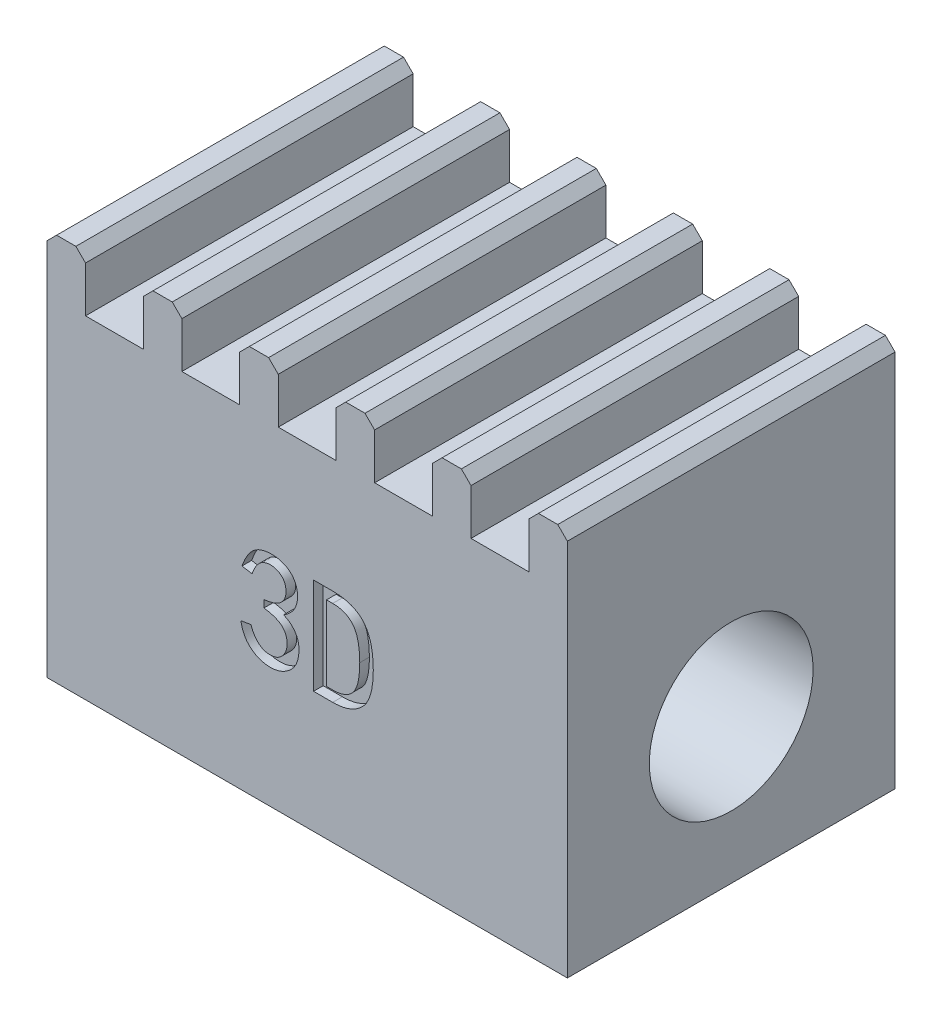
from build123d import *

# Parameters (mm, degrees)
EXTRUDE_1_DEPTH     = 6.8
SKETCH_2_R          = 1.7
CUT_EXTRUDE_1_DEPTH = 4
CUT_EXTRUDE_2_DEPTH = 0.2


with BuildPart() as part:
    # 草图1 → 凸台-拉伸1 (new body)
    with BuildSketch(Plane.XY):
        Polygon((-5.4, 3.45), (-5.4, 4.4), (-5.2, 4.6), (-4.8, 4.6), (-4.6, 4.4), (-4.6, 3.45), (-3.4, 3.45), (-3.4, 4.4), (-3.2, 4.6), (-2.8, 4.6), (-2.6, 4.4), (-2.6, 3.45), (-1.4, 3.45), (-1.4, 4.4), (-1.2, 4.6), (-0.8, 4.6), (-0.6, 4.4), (-0.6, 3.45), (0.6, 3.45), (0.6, 4.4), (0.8, 4.6), (1.2, 4.6), (1.4, 4.4), (1.4, 3.45), (2.6, 3.45), (2.6, 4.4), (2.8, 4.6), (3.2, 4.6), (3.4, 4.4), (3.4, 3.45), (4.6, 3.45), (4.6, 4.4), (4.8, 4.6), (5.2, 4.6), (5.4, 4.4), (5.4, 3.45), (5.4, -3.45), (-5.4, -3.45), align=None)
    extrude(amount=EXTRUDE_1_DEPTH)

    # 草图2 → 切除-拉伸1 (cut)
    with BuildSketch(Plane(origin=(5.4, 0, 0), x_dir=(0, 0, -1), z_dir=(1, 0, 0))):
        with Locations((-3.4, -0.45)):
            Circle(SKETCH_2_R)
    cut_extrude_1 = extrude(amount=-CUT_EXTRUDE_1_DEPTH, mode=Mode.SUBTRACT)

    # 镜向1: 切除-拉伸1 across plane
    add(cut_extrude_1.mirror(Plane(origin=(0, 0, 0), x_dir=(0, 0, 1), z_dir=(1, 0, 0))), mode=Mode.SUBTRACT)

    # 草图3 → 切除-拉伸2 (cut)
    # profile 1 of 2: a face of its own
    with BuildSketch(Plane.XY.offset(6.8)):
        with BuildLine():
            Line((-1.376457279, -0.416282911), (-1.165930963, -0.381195192))
            add(Edge.make_bspline(
                [(-1.165930963, -0.381195192), (-1.15763244, -0.405720082), (-1.141333021, -0.453890272), (-1.106114077, -0.520415987), (-1.06401868, -0.580441449), (-1.023632873, -0.625393193), (-0.987128455, -0.656089708), (-0.958336566, -0.676176694), (-0.928077592, -0.693408889), (-0.89549861, -0.706052061), (-0.861800678, -0.716931797), (-0.826074572, -0.723038647), (-0.789007316, -0.726527707), (-0.75086723, -0.727127825), (-0.712853637, -0.723652622), (-0.676142005, -0.716705208), (-0.641313357, -0.706435041), (-0.608513045, -0.692092384), (-0.57820423, -0.673507247), (-0.549219408, -0.652372243), (-0.522672765, -0.626964076), (-0.49881828, -0.598059787), (-0.477243557, -0.567033353), (-0.458598286, -0.534613197), (-0.443195955, -0.501016549), (-0.431688977, -0.466229957), (-0.422739411, -0.430503677), (-0.417800497, -0.393612088), (-0.415432215, -0.35565775), (-0.416983009, -0.31712675), (-0.420906258, -0.279081503), (-0.428920795, -0.242717218), (-0.439701922, -0.208675324), (-0.453084085, -0.176315733), (-0.47051918, -0.146751715), (-0.490593904, -0.119099091), (-0.513736873, -0.093696828), (-0.540511452, -0.070687756), (-0.570644969, -0.049329268), (-0.604803739, -0.029605977), (-0.643467015, -0.01228199), (-0.685817718, 0.004418275), (-0.732721754, 0.018488043), (-0.783575046, 0.031430681), (-0.838791546, 0.042751158), (-0.877113145, 0.048553553), (-0.896925115, 0.051553346)],
                knots=[0, 0, 0, 0, 1.854799748, 3.643076762, 5.375778243, 7.105784308, 7.958514958, 8.791774595, 9.621744654, 10.44880128, 11.294076632, 12.157496915, 13.041787632, 13.96367637, 14.889223527, 15.774908308, 16.640004354, 17.48869958, 18.334228731, 19.185637365, 20.057465777, 20.961908388, 21.86984341, 22.765285775, 23.641349219, 24.5158806, 25.390105247, 26.279235462, 27.181837661, 28.114543598, 29.042174801, 29.921843334, 30.780091711, 31.601551697, 32.427634894, 33.235597725, 34.049381879, 34.886366892, 35.762920031, 36.695625967, 37.710569643, 38.799256358, 39.959035312, 41.220118669, 42.562822875, 44, 44, 44, 44], degree=3))
            Line((-0.896925115, 0.051553346), (-0.896925115, 0.20360013))
            add(Edge.make_bspline(
                [(-0.896925115, 0.20360013), (-0.877102803, 0.205624125), (-0.838732222, 0.209542026), (-0.783592337, 0.219919832), (-0.73252684, 0.231607377), (-0.685759879, 0.24645762), (-0.64313542, 0.263760481), (-0.604483252, 0.283421007), (-0.570279532, 0.306231941), (-0.540274623, 0.331436475), (-0.514036455, 0.358836798), (-0.491897392, 0.388427632), (-0.473437619, 0.41989829), (-0.459025031, 0.453519731), (-0.448862104, 0.489225261), (-0.441568924, 0.526744143), (-0.439416403, 0.566295622), (-0.440177922, 0.607006927), (-0.44453457, 0.647319158), (-0.45381178, 0.685521825), (-0.466873068, 0.720849463), (-0.483543727, 0.753665386), (-0.505334184, 0.7829203), (-0.530505308, 0.809563191), (-0.559851093, 0.833067456), (-0.592673385, 0.853254273), (-0.627802718, 0.869741353), (-0.663754841, 0.88316544), (-0.700527363, 0.891218179), (-0.737666033, 0.895588031), (-0.775475478, 0.896270811), (-0.813769721, 0.891555392), (-0.852666503, 0.883295144), (-0.891899693, 0.870899188), (-0.930930731, 0.853411579), (-0.967535555, 0.828157067), (-1.001766118, 0.796453548), (-1.034803738, 0.758894021), (-1.06456786, 0.713873849), (-1.093326604, 0.663038736), (-1.119856183, 0.605522066), (-1.134768187, 0.56427575), (-1.14253915, 0.542781416)],
                knots=[0, 0, 0, 0, 1.385117707, 2.68120955, 3.899080185, 5.026526245, 6.089471502, 7.095537128, 8.036926677, 8.942108935, 9.815771246, 10.669349366, 11.506404864, 12.347666396, 13.205663414, 14.084102859, 14.999917747, 15.954128211, 16.914501223, 17.813254747, 18.680661639, 19.529560311, 20.363114732, 21.208382436, 22.07252795, 22.96987783, 23.881720011, 24.767988279, 25.632833695, 26.492298631, 27.366018653, 28.255410494, 29.169296362, 30.128408489, 31.112431375, 32.1318401, 33.205217515, 34.351116983, 35.601710711, 36.950682265, 38.410935554, 40, 40, 40, 40], degree=3))
            Line((-1.14253915, 0.542781416), (-1.353065466, 0.577869136))
            add(Edge.make_bspline(
                [(-1.353065466, 0.577869136), (-1.340793285, 0.611744799), (-1.316879833, 0.677754581), (-1.272193363, 0.770574903), (-1.220331745, 0.854226052), (-1.171714163, 0.91736037), (-1.129011661, 0.962701667), (-1.09359988, 0.991929444), (-1.056061554, 1.018493878), (-1.015415176, 1.040719324), (-0.972142829, 1.059675069), (-0.92603079, 1.074176188), (-0.877369031, 1.085458897), (-0.826662811, 1.093114665), (-0.775569612, 1.097171252), (-0.725365722, 1.098820261), (-0.676783535, 1.096292679), (-0.629667954, 1.091993192), (-0.584401991, 1.083503784), (-0.540718241, 1.072389942), (-0.498890577, 1.057433937), (-0.458435143, 1.040360574), (-0.420634444, 1.019940944), (-0.385029835, 0.997578556), (-0.353166927, 0.971615638), (-0.323186024, 0.944170405), (-0.297447376, 0.912952972), (-0.273680008, 0.879846158), (-0.252956184, 0.844063947), (-0.235779566, 0.805775108), (-0.221432482, 0.766124834), (-0.210696412, 0.725060661), (-0.202686452, 0.683269257), (-0.198928345, 0.640329328), (-0.198488519, 0.596734458), (-0.201605674, 0.552133324), (-0.208192507, 0.50669249), (-0.217944253, 0.460527619), (-0.231978168, 0.414390927), (-0.252185769, 0.36951998), (-0.277869794, 0.326168756), (-0.308982374, 0.284273582), (-0.345474393, 0.243875132), (-0.387889354, 0.205480769), (-0.435202089, 0.16788756), (-0.469762398, 0.14514302), (-0.48756839, 0.133424691)],
                knots=[0, 0, 0, 0, 2.088435488, 4.069504719, 5.960900737, 7.786563479, 8.680771598, 9.566313178, 10.444341104, 11.343825986, 12.247587673, 13.179685867, 14.142420713, 15.141886465, 16.150152099, 17.113396579, 18.05212794, 18.969441419, 19.854666253, 20.719823891, 21.58047219, 22.428151748, 23.263500765, 24.069461113, 24.861911808, 25.643808195, 26.422154676, 27.202794716, 28.005617324, 28.815006474, 29.633397489, 30.44783822, 31.273903418, 32.097929155, 32.94366283, 33.799737089, 34.68784804, 35.604243899, 36.533818883, 37.478357806, 38.450549751, 39.450331118, 40.49965591, 41.60193164, 42.764479089, 44, 44, 44, 44], degree=3))
            add(Edge.make_bspline(
                [(-0.48756839, 0.133424691), (-0.461435398, 0.121056438), (-0.410274319, 0.096842862), (-0.341860196, 0.047856524), (-0.283129917, -0.009901885), (-0.242483511, -0.065185088), (-0.215016138, -0.113397223), (-0.198664978, -0.153024472), (-0.186164716, -0.195313932), (-0.17713201, -0.240109514), (-0.171398966, -0.287615196), (-0.169963189, -0.337880484), (-0.171640239, -0.390995768), (-0.177289867, -0.445840079), (-0.186321541, -0.500895827), (-0.200814692, -0.553906024), (-0.219348169, -0.604287796), (-0.24252824, -0.652134021), (-0.270544786, -0.697026752), (-0.303633034, -0.738874502), (-0.340317709, -0.778602596), (-0.381935441, -0.814518117), (-0.426028711, -0.847238605), (-0.472303174, -0.875585339), (-0.519925618, -0.899498575), (-0.569082331, -0.918674969), (-0.619737742, -0.93300469), (-0.671776947, -0.942902399), (-0.725382615, -0.948696957), (-0.779870876, -0.949314302), (-0.834217929, -0.946074601), (-0.887125749, -0.937949405), (-0.938436971, -0.927113832), (-0.987690916, -0.911069423), (-1.035450599, -0.891897846), (-1.080867784, -0.867783805), (-1.124696171, -0.840265471), (-1.166495326, -0.808920688), (-1.205634613, -0.773347663), (-1.241220162, -0.733666232), (-1.273582323, -0.690415685), (-1.300955949, -0.642615433), (-1.326188756, -0.591823591), (-1.346483063, -0.536633778), (-1.36425914, -0.477996172), (-1.372330552, -0.437160993), (-1.376457279, -0.416282911)],
                knots=[0, 0, 0, 0, 1.556863988, 3.047903747, 4.51274202, 5.983117829, 6.732724558, 7.500714565, 8.289161914, 9.10779992, 9.96267821, 10.866591561, 11.817204889, 12.826910154, 13.838355827, 14.822602624, 15.786048742, 16.729939345, 17.685039949, 18.633769323, 19.603521256, 20.596937443, 21.593797024, 22.562140776, 23.519904659, 24.464277043, 25.403497682, 26.355035653, 27.318261422, 28.307425488, 29.290655039, 30.251043242, 31.192037974, 32.115630974, 33.041191859, 33.964292232, 34.884727864, 35.830159304, 36.778345149, 37.732302073, 38.701115445, 39.685485474, 40.699027657, 41.756353326, 42.852875359, 44, 44, 44, 44], degree=3))
        make_face()
    # profile 2 of 2: a face of its own
    with BuildSketch(Plane.XY.offset(6.8)):
        with BuildLine():
            add(Edge.make_bspline(
                [(1.372080733, 0.063249252), (1.371513283, 0.020048959), (1.370418188, -0.063321304), (1.359328666, -0.183565652), (1.342154315, -0.294323987), (1.317051872, -0.39537803), (1.285154775, -0.486902246), (1.246368291, -0.569057334), (1.19976949, -0.641472537), (1.145507844, -0.703713383), (1.085408743, -0.757386196), (1.020561257, -0.803854152), (0.951080936, -0.843704224), (0.876112076, -0.875149726), (0.79674506, -0.900532406), (0.712087457, -0.917959889), (0.622689201, -0.929157539), (0.561344043, -0.930312308), (0.52997547, -0.930902794)],
                knots=[0, 0, 0, 0, 1.389524785, 2.681580087, 3.881416849, 4.992360851, 6.026729756, 6.995017906, 7.908603538, 8.787894915, 9.643211222, 10.495393011, 11.350494818, 12.214247491, 13.106065295, 14.027214329, 14.991224842, 16, 16, 16, 16], degree=3))
            Line((0.52997547, -0.930902794), (0.132314651, -0.930902794))
            Line((0.132314651, -0.930902794), (0.132314651, 1.069097206))
            Line((0.132314651, 1.069097206), (0.52997547, 1.069097206))
            add(Edge.make_bspline(
                [(0.52997547, 1.069097206), (0.564954813, 1.068565446), (0.632654813, 1.067536263), (0.730421724, 1.055863501), (0.821147646, 1.038065717), (0.904814733, 1.012499338), (0.981595217, 0.97972782), (1.050965498, 0.939027503), (1.113761102, 0.891719143), (1.168879808, 0.835776667), (1.217613501, 0.771737059), (1.259227878, 0.698202642), (1.293972523, 0.615316559), (1.323249443, 0.523349347), (1.344732722, 0.421556527), (1.360470872, 0.310557823), (1.370764797, 0.190074825), (1.371631034, 0.106589772), (1.372080733, 0.063249252)],
                knots=[0, 0, 0, 0, 1.107739609, 2.143950281, 3.114742919, 4.033667788, 4.910720376, 5.753428295, 6.576026955, 7.394480551, 8.23354201, 9.118765776, 10.063698003, 11.076506874, 12.172173314, 13.355526632, 14.627145244, 16, 16, 16, 16], degree=3))
        make_face()
        with BuildLine():
            add(Edge.make_bspline(
                [(1.091378978, 0.063249252), (1.090978807, 0.097912337), (1.090207713, 0.164704909), (1.083915678, 0.261055471), (1.072558299, 0.349371953), (1.057983234, 0.429898206), (1.037928132, 0.501968799), (1.014450915, 0.566393551), (0.985813785, 0.622707344), (0.952651628, 0.671542446), (0.914772713, 0.713228479), (0.872721499, 0.749211207), (0.826212543, 0.779490816), (0.775377763, 0.80457007), (0.720088419, 0.823303503), (0.660656637, 0.837321066), (0.596773609, 0.845571954), (0.552669637, 0.846432289), (0.52997547, 0.846874983)],
                knots=[0, 0, 0, 0, 1.50261862, 2.895407767, 4.182685949, 5.361245188, 6.439488336, 7.421939034, 8.328969596, 9.171036484, 9.973163414, 10.763455177, 11.563821661, 12.37285522, 13.214177287, 14.088724386, 15.01653284, 16, 16, 16, 16], degree=3))
            Line((0.52997547, 0.846874983), (0.401320499, 0.846874983))
            Line((0.401320499, 0.846874983), (0.401320499, -0.708680572))
            Line((0.401320499, -0.708680572), (0.52997547, -0.708680572))
            add(Edge.make_bspline(
                [(0.52997547, -0.708680572), (0.552665685, -0.708197348), (0.596743943, -0.707258633), (0.66063083, -0.699570925), (0.720075406, -0.685990146), (0.775258594, -0.667616512), (0.826057917, -0.643452677), (0.872666471, -0.614530505), (0.914750987, -0.57985521), (0.952474133, -0.539504546), (0.986076293, -0.492236139), (1.014401795, -0.436853811), (1.038032613, -0.373207226), (1.057911245, -0.301797372), (1.072576831, -0.222016553), (1.08396434, -0.134273281), (1.090199227, -0.038205735), (1.090975908, 0.028586397), (1.091378978, 0.063249252)],
                knots=[0, 0, 0, 0, 0.9908866, 1.924907101, 2.80462885, 3.650254363, 4.45990781, 5.256111711, 6.040209073, 6.834462288, 7.662189065, 8.564851509, 9.54291023, 10.623211397, 11.798270521, 13.082748796, 14.486045376, 16, 16, 16, 16], degree=3))
        make_face(mode=Mode.SUBTRACT)
    extrude(amount=-CUT_EXTRUDE_2_DEPTH, mode=Mode.SUBTRACT)


solid = part.part
